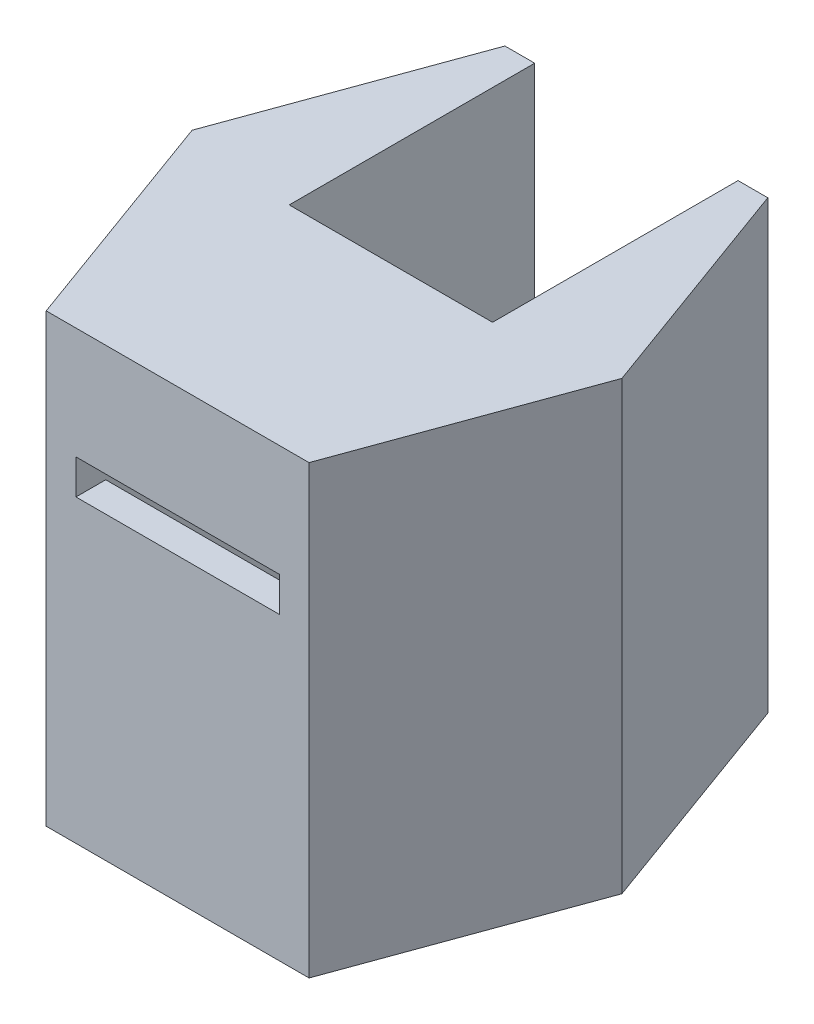
from build123d import *

# Parameters (mm, degrees)
BOSS_EXTRUDE1_DEPTH = 45
SKETCH2_W           = 20.5
SKETCH2_H           = 2
BOSS_EXTRUDE2_DEPTH = 18.5
SKETCH3_W           = 20.5
SKETCH3_H           = 3.5
CUT_EXTRUDE1_DEPTH  = 20
SKETCH4_W           = 20.5
SKETCH4_H           = 3
BOSS_EXTRUDE3_DEPTH = 43.25


with BuildPart() as part:
    # Sketch1 → Boss-Extrude1 (new body)
    with BuildSketch(Plane(origin=(0, 0, 0), x_dir=(1, 0, 0), z_dir=(0, 1, 0))):
        Polygon((0, 0), (26.5, 0), (34.916811667, 23.125), (26.5, 46.25), (23.5, 46.25), (23.5, 3), (3, 3), (3, 46.25), (0, 46.25), (-8.416811667, 23.125), align=None)
    extrude(amount=BOSS_EXTRUDE1_DEPTH)

    # Sketch2 → Boss-Extrude2 (add)
    with BuildSketch(Plane(origin=(0, 0, -3), x_dir=(-1, 0, 0), z_dir=(0, 0, -1))):
        with Locations((-13.25, 44)):
            Rectangle(SKETCH2_W, SKETCH2_H)
    extrude(amount=BOSS_EXTRUDE2_DEPTH)

    # Sketch3 → Cut-Extrude1 (cut)
    with BuildSketch(Plane(origin=(0, 0, -3), x_dir=(-1, 0, 0), z_dir=(0, 0, -1))):
        with Locations((-13.25, 32)):
            Rectangle(SKETCH3_W, SKETCH3_H)
    extrude(amount=-CUT_EXTRUDE1_DEPTH, mode=Mode.SUBTRACT)

    # Sketch4 → Boss-Extrude3 (add)
    with BuildSketch(Plane(origin=(0, 0, -3), x_dir=(-1, 0, 0), z_dir=(0, 0, -1))):
        with Locations((-13.25, 1.5)):
            Rectangle(SKETCH4_W, SKETCH4_H)
    extrude(amount=BOSS_EXTRUDE3_DEPTH)


solid = part.part
